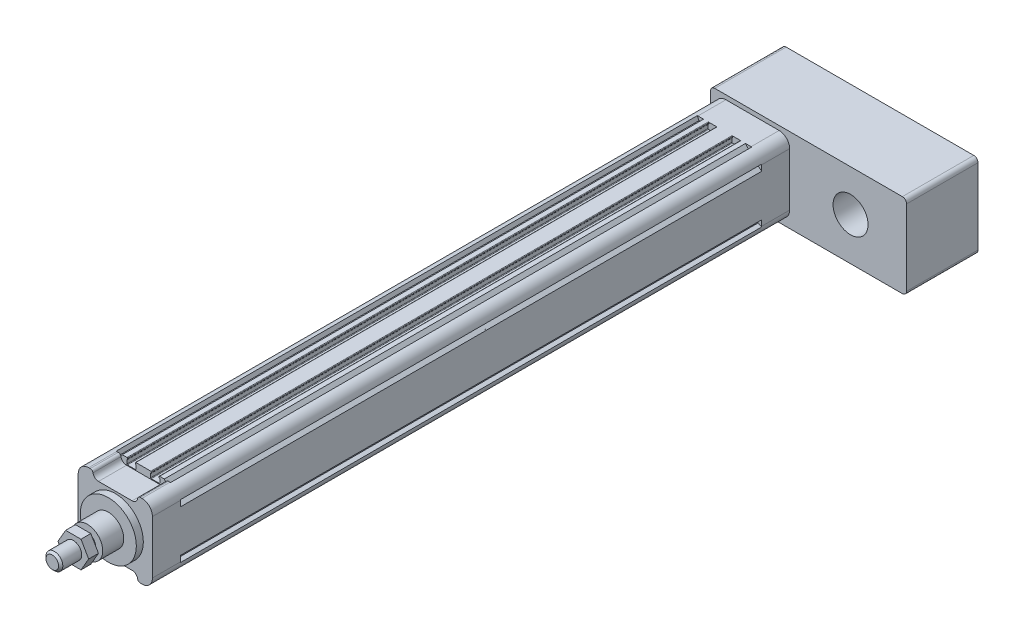
from build123d import *

# Parameters (mm, degrees)
SKETCH_1_R                  = 2.1
EXTRUDE_1_DEPTH             = 415
EXTRUDE_2_DEPTH             = 20
SKETCH_7_R                  = 20
EXTRUDE_3_DEPTH             = 5
SKETCH_9_R                  = 11
EXTRUDE_4_DEPTH             = 15
SKETCH_10_R                 = 6
EXTRUDE_5_DEPTH             = 25
EXTRUDE_START               = 20
EXTRUDE_6_DEPTH             = 20
EXTRUDE_7_DEPTH             = 51
SKETCH_13_R                 = 12.5
CUT_EXTRUDE_2_DEPTH         = 30
PATTERN_LINEAR_1_COUNT      = 2
PATTERN_LINEAR_1_PITCH      = 38
PATTERN_LINEAR_1_COUNT_DIR2 = 2
PATTERN_LINEAR_1_PITCH_DIR2 = 38
HOLE_WIZARD_M6_2_D          = 5
HOLE_WIZARD_M6_2_DEPTH      = 15
HOLE_WIZARD_M6_2_TIP        = 1.502151548
HOLE_WIZARD_M6_3_D          = 5
HOLE_WIZARD_M6_3_DEPTH      = 15
HOLE_WIZARD_M6_3_TIP        = 1.502151548
HOLE_WIZARD_M6_4_D          = 5
HOLE_WIZARD_M6_4_DEPTH      = 15
HOLE_WIZARD_M6_4_TIP        = 1.502151548
CHAMFER_1_SIZE              = 1.5
EXTRUDE_START_2             = 3
EXTRUDE_8_DEPTH             = 7


with BuildPart() as part:
    # 草图1 → 凸台-拉伸1 (new body)
    with BuildSketch(Plane.XY):
        with BuildLine():
            Line((-18.2, 24), (-19.443439638, 26.486879276))
            ThreePointArc((-19.443439638, 26.486879276), (-24.303300859, 24.303300859), (-26.486879276, 19.443439638))
            Line((-26.486879276, 19.443439638), (-24, 18.2))
            Line((-24, 18.2), (-24, 17.1))
            Line((-24, 17.1), (-26.5, 15))
            Line((-26.5, 15), (-26.5, -15))
            Line((-26.5, -15), (-24, -17.1))
            Line((-24, -17.1), (-24, -18.2))
            Line((-24, -18.2), (-26.486879276, -19.443439638))
            ThreePointArc((-26.486879276, -19.443439638), (-24.303300859, -24.303300859), (-19.443439638, -26.486879276))
            Line((-19.443439638, -26.486879276), (-18.2, -24))
            Line((-18.2, -24), (-17.1, -24))
            Line((-17.1, -24), (-15, -26.5))
            Line((-15, -26.5), (-11.65, -26.5))
            ThreePointArc((-11.65, -26.5), (-11.367157288, -26.382842712), (-11.25, -26.1))
            Line((-11.25, -26.1), (-11.25, -25.6))
            ThreePointArc((-11.25, -25.6), (-11.367157288, -25.317157288), (-11.65, -25.2))
            Line((-11.65, -25.2), (-11.75, -25.2))
            Line((-11.75, -25.2), (-11.75, -22.4))
            ThreePointArc((-11.75, -22.4), (-11.632842712, -22.117157288), (-11.35, -22))
            Line((-11.35, -22), (-5.65, -22))
            ThreePointArc((-5.65, -22), (-5.367157288, -22.117157288), (-5.25, -22.4))
            Line((-5.25, -22.4), (-5.25, -25.2))
            Line((-5.25, -25.2), (-5.35, -25.2))
            ThreePointArc((-5.35, -25.2), (-5.632842712, -25.317157288), (-5.75, -25.6))
            Line((-5.75, -25.6), (-5.75, -26.1))
            ThreePointArc((-5.75, -26.1), (-5.632842712, -26.382842712), (-5.35, -26.5))
            Line((-5.35, -26.5), (5.35, -26.5))
            ThreePointArc((5.35, -26.5), (5.632842712, -26.382842712), (5.75, -26.1))
            Line((5.75, -26.1), (5.75, -25.6))
            ThreePointArc((5.75, -25.6), (5.632842712, -25.317157288), (5.35, -25.2))
            Line((5.35, -25.2), (5.25, -25.2))
            Line((5.25, -25.2), (5.25, -22.4))
            ThreePointArc((5.25, -22.4), (5.367157288, -22.117157288), (5.65, -22))
            Line((5.65, -22), (11.35, -22))
            ThreePointArc((11.35, -22), (11.632842712, -22.117157288), (11.75, -22.4))
            Line((11.75, -22.4), (11.75, -25.2))
            Line((11.75, -25.2), (11.65, -25.2))
            ThreePointArc((11.65, -25.2), (11.367157288, -25.317157288), (11.25, -25.6))
            Line((11.25, -25.6), (11.25, -26.1))
            ThreePointArc((11.25, -26.1), (11.367157288, -26.382842712), (11.65, -26.5))
            Line((11.65, -26.5), (15, -26.5))
            Line((15, -26.5), (17.1, -24))
            Line((17.1, -24), (18.2, -24))
            Line((18.2, -24), (19.443439638, -26.486879276))
            ThreePointArc((19.443439638, -26.486879276), (24.303300859, -24.303300859), (26.486879276, -19.443439638))
            Line((26.486879276, -19.443439638), (24, -18.2))
            Line((24, -18.2), (24, -17.1))
            Line((24, -17.1), (26.5, -15))
            Line((26.5, -15), (26.5, 15))
            Line((26.5, 15), (24, 17.1))
            Line((24, 17.1), (24, 18.2))
            Line((24, 18.2), (26.486879276, 19.443439638))
            ThreePointArc((26.486879276, 19.443439638), (24.303300859, 24.303300859), (19.443439638, 26.486879276))
            Line((19.443439638, 26.486879276), (18.2, 24))
            Line((18.2, 24), (17.1, 24))
            Line((17.1, 24), (15, 26.5))
            Line((15, 26.5), (11.65, 26.5))
            ThreePointArc((11.65, 26.5), (11.367157288, 26.382842712), (11.25, 26.1))
            Line((11.25, 26.1), (11.25, 25.6))
            ThreePointArc((11.25, 25.6), (11.367157288, 25.317157288), (11.65, 25.2))
            Line((11.65, 25.2), (11.75, 25.2))
            Line((11.75, 25.2), (11.75, 22.4))
            ThreePointArc((11.75, 22.4), (11.632842712, 22.117157288), (11.35, 22))
            Line((11.35, 22), (5.65, 22))
            ThreePointArc((5.65, 22), (5.367157288, 22.117157288), (5.25, 22.4))
            Line((5.25, 22.4), (5.25, 25.2))
            Line((5.25, 25.2), (5.35, 25.2))
            ThreePointArc((5.35, 25.2), (5.632842712, 25.317157288), (5.75, 25.6))
            Line((5.75, 25.6), (5.75, 26.1))
            ThreePointArc((5.75, 26.1), (5.632842712, 26.382842712), (5.35, 26.5))
            Line((5.35, 26.5), (-5.35, 26.5))
            ThreePointArc((-5.35, 26.5), (-5.632842712, 26.382842712), (-5.75, 26.1))
            Line((-5.75, 26.1), (-5.75, 25.6))
            ThreePointArc((-5.75, 25.6), (-5.632842712, 25.317157288), (-5.35, 25.2))
            Line((-5.35, 25.2), (-5.25, 25.2))
            Line((-5.25, 25.2), (-5.25, 22.4))
            ThreePointArc((-5.25, 22.4), (-5.367157288, 22.117157288), (-5.65, 22))
            Line((-5.65, 22), (-11.35, 22))
            ThreePointArc((-11.35, 22), (-11.632842712, 22.117157288), (-11.75, 22.4))
            Line((-11.75, 22.4), (-11.75, 25.2))
            Line((-11.75, 25.2), (-11.65, 25.2))
            ThreePointArc((-11.65, 25.2), (-11.367157288, 25.317157288), (-11.25, 25.6))
            Line((-11.25, 25.6), (-11.25, 26.1))
            ThreePointArc((-11.25, 26.1), (-11.367157288, 26.382842712), (-11.65, 26.5))
            Line((-11.65, 26.5), (-15, 26.5))
            Line((-15, 26.5), (-17.1, 24))
            Line((-17.1, 24), (-18.2, 24))
        make_face()
        with Locations((19, 19)):
            Circle(SKETCH_1_R, mode=Mode.SUBTRACT)
        with Locations((19, -19)):
            Circle(SKETCH_1_R, mode=Mode.SUBTRACT)
        with Locations((-19, -19)):
            Circle(SKETCH_1_R, mode=Mode.SUBTRACT)
        with Locations((-19, 19)):
            Circle(SKETCH_1_R, mode=Mode.SUBTRACT)
        with BuildLine():
            Line((19.773719933, 3), (23.3, 3))
            Line((23.3, 3), (23.3, -3))
            Line((23.3, -3), (19.773719933, -3))
            ThreePointArc((19.773719933, -3), (0, -20), (-19.773719933, -3))
            Line((-19.773719933, -3), (-23.3, -3))
            Line((-23.3, -3), (-23.3, 3))
            Line((-23.3, 3), (-19.773719933, 3))
            ThreePointArc((-19.773719933, 3), (0, 20), (19.773719933, 3))
        make_face(mode=Mode.SUBTRACT)
    extrude(amount=EXTRUDE_1_DEPTH)

    # 草图6 → 凸台-拉伸2 (add)
    with BuildSketch(Plane.XY.offset(415)):
        with BuildLine():
            Line((-26.5, -19), (-26.5, 19))
            ThreePointArc((-26.5, 19), (-24.303300859, 24.303300859), (-19, 26.5))
            Line((-19, 26.5), (-17.916079783, 26.5))
            ThreePointArc((-17.916079783, 26.5), (-16.625085334, 26.027525232), (-15.944053189, 24.833333333))
            ThreePointArc((-15.944053189, 24.833333333), (-14.581988897, 22.444949537), (-12, 21.5))
            Line((-12, 21.5), (12, 21.5))
            ThreePointArc((12, 21.5), (14.581988897, 22.444949537), (15.944053189, 24.833333333))
            ThreePointArc((15.944053189, 24.833333333), (16.625085334, 26.027525232), (17.916079783, 26.5))
            Line((17.916079783, 26.5), (19, 26.5))
            ThreePointArc((19, 26.5), (24.303300859, 24.303300859), (26.5, 19))
            Line((26.5, 19), (26.5, -19))
            ThreePointArc((26.5, -19), (24.303300859, -24.303300859), (19, -26.5))
            Line((19, -26.5), (17.916079783, -26.5))
            ThreePointArc((17.916079783, -26.5), (16.625085334, -26.027525232), (15.944053189, -24.833333333))
            ThreePointArc((15.944053189, -24.833333333), (14.581988897, -22.444949537), (12, -21.5))
            Line((12, -21.5), (-12, -21.5))
            ThreePointArc((-12, -21.5), (-14.581988897, -22.444949537), (-15.944053189, -24.833333333))
            ThreePointArc((-15.944053189, -24.833333333), (-16.625085334, -26.027525232), (-17.916079783, -26.5))
            Line((-17.916079783, -26.5), (-19, -26.5))
            ThreePointArc((-19, -26.5), (-24.303300859, -24.303300859), (-26.5, -19))
        make_face()
    extrude(amount=EXTRUDE_2_DEPTH)

    # 草图7 → 凸台-拉伸3 (add)
    with BuildSketch(Plane.XY.offset(435)):
        Circle(SKETCH_7_R)
    extrude(amount=EXTRUDE_3_DEPTH)

    # 草图9 → 凸台-拉伸4 (add)
    with BuildSketch(Plane.XY.offset(440)):
        Circle(SKETCH_9_R)
    extrude(amount=EXTRUDE_4_DEPTH)

    # 草图10 → 凸台-拉伸5 (add)
    with BuildSketch(Plane.XY.offset(455)):
        Circle(SKETCH_10_R)
    extrude(amount=EXTRUDE_5_DEPTH)

    # 草图11 → 凸台-拉伸6 (add)
    with BuildSketch(Plane(origin=(0, 0, 0), x_dir=(-1, 0, 0), z_dir=(0, 0, -1)).offset(EXTRUDE_START)):
        with BuildLine():
            Line((-19, -26.5), (19, -26.5))
            ThreePointArc((19, -26.5), (24.303300859, -24.303300859), (26.5, -19))
            Line((26.5, -19), (26.5, 19))
            ThreePointArc((26.5, 19), (24.303300859, 24.303300859), (19, 26.5))
            Line((19, 26.5), (-19, 26.5))
            ThreePointArc((-19, 26.5), (-24.303300859, 24.303300859), (-26.5, 19))
            Line((-26.5, 19), (-26.5, -19))
            ThreePointArc((-26.5, -19), (-24.303300859, -24.303300859), (-19, -26.5))
        make_face()
    extrude(amount=-EXTRUDE_6_DEPTH)

    # 草图12 → 凸台-拉伸7 (add)
    with BuildSketch(Plane(origin=(0, 0, -20), x_dir=(-1, 0, 0), z_dir=(0, 0, -1))):
        with BuildLine():
            Line((-107, -30.404162038), (27, -30.404162038))
            ThreePointArc((27, -30.404162038), (29.121320344, -29.525482382), (30, -27.404162038))
            Line((30, -27.404162038), (30, 26.595837962))
            ThreePointArc((30, 26.595837962), (29.121320344, 28.717158305), (27, 29.595837962))
            Line((27, 29.595837962), (-107, 29.595837962))
            ThreePointArc((-107, 29.595837962), (-109.121320344, 28.717158305), (-110, 26.595837962))
            Line((-110, 26.595837962), (-110, -27.404162038))
            ThreePointArc((-110, -27.404162038), (-109.121320344, -29.525482382), (-107, -30.404162038))
        make_face()
    extrude(amount=EXTRUDE_7_DEPTH)

    # 草图13 → 切除-拉伸2 (cut)
    with BuildSketch(Plane.XY.offset(-20)):
        with Locations((70, 0)):
            Circle(SKETCH_13_R)
    extrude(amount=-CUT_EXTRUDE_2_DEPTH, mode=Mode.SUBTRACT)

    # 草图15 → M6 螺纹孔1 (revolve, cut)
    with BuildSketch(Plane(origin=(-19, -19, -71), x_dir=(0, 1, 0), z_dir=(1, 0, 0))):
        Polygon((0, 0), (0, 16.502151548), (2.5, 15), (2.5, 0), align=None)
    hole_wizard_m6_1 = revolve(axis=Axis((-19, -19, -77.35), (0, 0, 1)), mode=Mode.SUBTRACT)

    # 阵列(线性)1: Hole Wizard M6 _1 2 × 2
    with Locations(*[(j * PATTERN_LINEAR_1_PITCH_DIR2, i * PATTERN_LINEAR_1_PITCH, 0) for i in range(PATTERN_LINEAR_1_COUNT) for j in range(PATTERN_LINEAR_1_COUNT_DIR2) if (i, j) != (0, 0)]):
        add(hole_wizard_m6_1, mode=Mode.SUBTRACT)

    # M6 螺纹孔2
    with Locations(Plane(origin=(0, 0, -71), x_dir=(-1, 0, 0), z_dir=(0, 0, -1))):
        with Locations((-84, -19), (-84, 19)):
            Hole(HOLE_WIZARD_M6_2_D / 2, depth=HOLE_WIZARD_M6_2_DEPTH)
            with Locations((0, 0, -(HOLE_WIZARD_M6_2_DEPTH + HOLE_WIZARD_M6_2_TIP / 2))):  # 118° drill point
                Cone(0, HOLE_WIZARD_M6_2_D / 2, HOLE_WIZARD_M6_2_TIP, mode=Mode.SUBTRACT)

    # M6 螺纹孔3
    with Locations(Plane.ZY.offset(26.5)):
        with Locations((425, 11), (425, -11)):
            Hole(HOLE_WIZARD_M6_3_D / 2, depth=HOLE_WIZARD_M6_3_DEPTH)
            with Locations((0, 0, -(HOLE_WIZARD_M6_3_DEPTH + HOLE_WIZARD_M6_3_TIP / 2))):  # 118° drill point
                Cone(0, HOLE_WIZARD_M6_3_D / 2, HOLE_WIZARD_M6_3_TIP, mode=Mode.SUBTRACT)

    # M6 螺纹孔4
    with Locations(Plane.ZY.offset(26.5)):
        with Locations((-10, 11), (-10, -11)):
            Hole(HOLE_WIZARD_M6_4_D / 2, depth=HOLE_WIZARD_M6_4_DEPTH)
            with Locations((0, 0, -(HOLE_WIZARD_M6_4_DEPTH + HOLE_WIZARD_M6_4_TIP / 2))):  # 118° drill point
                Cone(0, HOLE_WIZARD_M6_4_D / 2, HOLE_WIZARD_M6_4_TIP, mode=Mode.SUBTRACT)

    # 倒角1
    chamfer_1_edges = [part.edges().sort_by_distance(p)[0] for p in [
        (-6, 0, 480),
    ]]
    chamfer(chamfer_1_edges, length=CHAMFER_1_SIZE)

    # 草图23 → 凸台-拉伸8 (add)
    with BuildSketch(Plane.XY.offset(455).offset(EXTRUDE_START_2)):
        Polygon((10.969655115, 0), (5.484827557, 9.5), (-5.484827557, 9.5), (-10.969655115, 0), (-5.484827557, -9.5), (5.484827557, -9.5), align=None)
    extrude(amount=EXTRUDE_8_DEPTH)


solid = part.part
